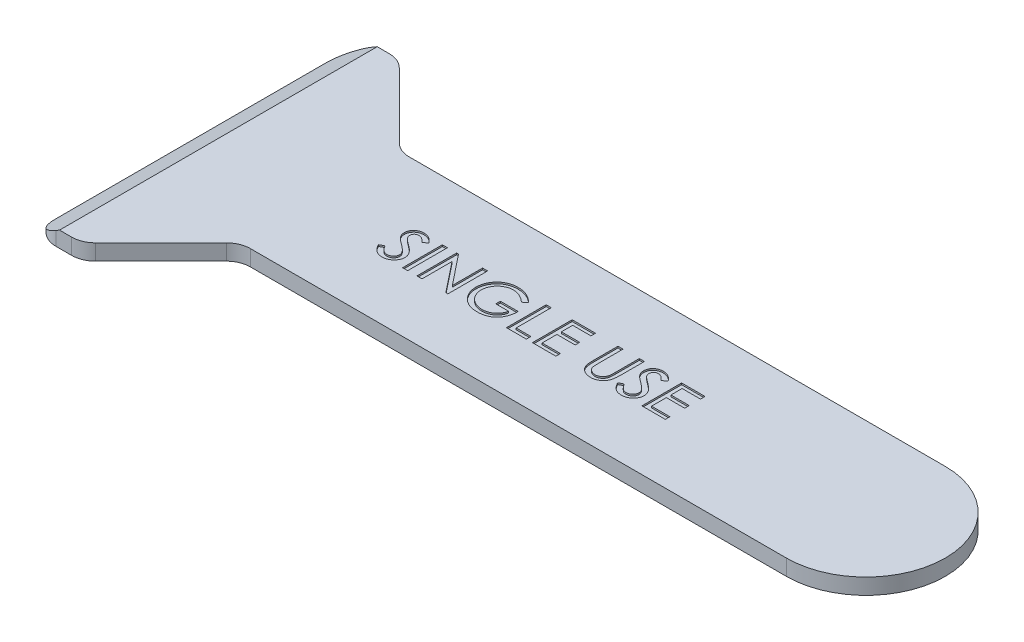
from build123d import *

# Parameters (mm, degrees)
BOSS_EXTRUDE1_DEPTH = 2
SKETCH2_W           = 0.641025641
SKETCH2_H           = 5
CUT_EXTRUDE1_DEPTH  = 0.2
CUT_EXTRUDE2_DEPTH  = 104.097041798


with BuildPart() as part:
    # Sketch1 → Boss-Extrude1 (new body)
    with BuildSketch(Plane(origin=(0, 0, 0), x_dir=(1, 0, 0), z_dir=(0, 1, 0))):
        with BuildLine():
            Line((3, 0), (5, 0))
            ThreePointArc((5, 0), (6.148050297, 0.228361402), (7.121320344, 0.878679656))
            Line((7.121320344, 0.878679656), (15.363961031, 9.121320344))
            ThreePointArc((15.363961031, 9.121320344), (16.337231077, 9.771638598), (17.485281374, 10))
            Line((17.485281374, 10), (85, 10))
            ThreePointArc((85, 10), (95, 20), (85, 30))
            Line((85, 30), (17.485281374, 30))
            ThreePointArc((17.485281374, 30), (16.337231077, 30.228361402), (15.363961031, 30.878679656))
            Line((15.363961031, 30.878679656), (7.121320344, 39.121320344))
            ThreePointArc((7.121320344, 39.121320344), (6.148050297, 39.771638598), (5, 40))
            Line((5, 40), (3, 40))
            ThreePointArc((3, 40), (0.878679656, 39.121320344), (0, 37))
            Line((0, 37), (0, 3))
            ThreePointArc((0, 3), (0.878679656, 0.878679656), (3, 0))
        make_face()
    extrude(amount=BOSS_EXTRUDE1_DEPTH)

    # Sketch2 → Cut-Extrude1 (cut)
    with BuildSketch(Plane(origin=(0, 2, 0), x_dir=(1, 0, 0), z_dir=(0, 1, 0))):
        with BuildLine():
            Line((25.128205128, 18.491586538), (25.673076923, 18.782051282))
            add(Edge.make_bspline(
                [(25.673076923, 18.782051282), (25.712784796, 18.716278253), (25.788677543, 18.590567773), (25.913297284, 18.421220831), (26.03720306, 18.276812397), (26.161617968, 18.157488278), (26.288270225, 18.065165172), (26.415866854, 17.998441335), (26.545206456, 17.956503185), (26.632657136, 17.951285127), (26.67568109, 17.948717949)],
                knots=[0, 0, 0, 0, 1.354943589, 2.589672558, 3.704607527, 4.708856974, 5.624398268, 6.459549776, 7.242129862, 8, 8, 8, 8], degree=3))
            add(Edge.make_bspline(
                [(26.67568109, 17.948717949), (26.715846266, 17.950009025), (26.795401925, 17.952566275), (26.912293458, 17.974743935), (27.025475413, 18.00853487), (27.132986556, 18.056652412), (27.232312083, 18.115602302), (27.31999469, 18.185720667), (27.394390938, 18.26510499), (27.455710693, 18.352678368), (27.503776775, 18.446180069), (27.53916079, 18.542956909), (27.559927676, 18.643287737), (27.562700789, 18.710843417), (27.564102564, 18.744991987)],
                knots=[0, 0, 0, 0, 1.0888553, 2.156709112, 3.216967111, 4.287545289, 5.343926646, 6.34269433, 7.323221176, 8.28571565, 9.233736345, 10.167849744, 11.073870434, 12, 12, 12, 12], degree=3))
            add(Edge.make_bspline(
                [(27.564102564, 18.744991987), (27.562138546, 18.783910579), (27.558169715, 18.862556151), (27.526314915, 18.979385088), (27.474545052, 19.095070908), (27.426656761, 19.167300865), (27.401842949, 19.204727564)],
                knots=[0, 0, 0, 0, 0.941861274, 1.903286225, 2.913566088, 4, 4, 4, 4], degree=3))
            add(Edge.make_bspline(
                [(27.401842949, 19.204727564), (27.38038635, 19.231971484), (27.335218388, 19.289322248), (27.258761839, 19.375664715), (27.169297642, 19.465732718), (27.066970923, 19.559119929), (26.953580275, 19.657918875), (26.827199575, 19.759576046), (26.688722244, 19.865809467), (26.591681174, 19.937079153), (26.541466346, 19.973958333)],
                knots=[0, 0, 0, 0, 0.718593868, 1.512701116, 2.388487339, 3.348232282, 4.383172848, 5.504845107, 6.708858268, 8, 8, 8, 8], degree=3))
            add(Edge.make_bspline(
                [(26.541466346, 19.973958333), (26.490260365, 20.011183426), (26.392010425, 20.082607956), (26.25358484, 20.187316647), (26.12947283, 20.283863863), (26.020626135, 20.372325064), (25.927032384, 20.453469116), (25.848888739, 20.52696305), (25.783842752, 20.590789999), (25.748888893, 20.633735765), (25.733173077, 20.653044872)],
                knots=[0, 0, 0, 0, 1.435833971, 2.754963323, 3.936484598, 5.002077172, 5.935979083, 6.744956812, 7.435712417, 8, 8, 8, 8], degree=3))
            add(Edge.make_bspline(
                [(25.733173077, 20.653044872), (25.710230109, 20.68268942), (25.665156802, 20.740928519), (25.608092435, 20.834347806), (25.558989825, 20.928989733), (25.518546545, 21.025730627), (25.487205438, 21.124261432), (25.465644239, 21.22492769), (25.450435343, 21.327329533), (25.449292476, 21.396511735), (25.448717949, 21.431290064)],
                knots=[0, 0, 0, 0, 1.064105702, 2.090521257, 3.104283852, 4.09061442, 5.065433238, 6.036507983, 7.012940167, 8, 8, 8, 8], degree=3))
            add(Edge.make_bspline(
                [(25.448717949, 21.431290064), (25.450527203, 21.485526289), (25.454109395, 21.592910046), (25.486121216, 21.749674244), (25.537996923, 21.899042527), (25.60880671, 22.040242896), (25.699229518, 22.170647035), (25.806783775, 22.287679611), (25.932051421, 22.388843371), (26.071690104, 22.474084547), (26.222204141, 22.543215707), (26.380730695, 22.592489233), (26.545347984, 22.622360588), (26.657194699, 22.626242512), (26.713741987, 22.628205128)],
                knots=[0, 0, 0, 0, 1.004530234, 1.988896367, 2.951881425, 3.928924249, 4.907494835, 5.884204368, 6.865296418, 7.88218147, 8.909671266, 9.927572845, 10.952225504, 12, 12, 12, 12], degree=3))
            add(Edge.make_bspline(
                [(26.713741987, 22.628205128), (26.777948206, 22.625906957), (26.905108932, 22.621355417), (27.092555797, 22.590510369), (27.271801053, 22.534975978), (27.416163324, 22.473676324), (27.528306402, 22.411002253), (27.613122506, 22.354396838), (27.700054638, 22.290335624), (27.786349399, 22.215625207), (27.875370092, 22.133880358), (27.962558142, 22.040657616), (28.053431219, 21.941299692), (28.111350392, 21.869645277), (28.141025641, 21.832932692)],
                knots=[0, 0, 0, 0, 1.360590218, 2.69465552, 4.010645498, 5.328858611, 6.009843139, 6.729980544, 7.488405022, 8.296451933, 9.147430815, 10.048128915, 10.999946711, 12, 12, 12, 12], degree=3))
            Line((28.141025641, 21.832932692), (27.618189103, 21.474358974))
            add(Edge.make_bspline(
                [(27.618189103, 21.474358974), (27.59090368, 21.503492421), (27.538440659, 21.559508728), (27.461268646, 21.638948411), (27.388253398, 21.710239848), (27.319173327, 21.773056905), (27.255576764, 21.828519844), (27.195676703, 21.874758443), (27.141346295, 21.914498418), (27.073428466, 21.953885119), (26.990166332, 21.99289312), (26.887690183, 22.027991374), (26.780197115, 22.046749233), (26.707462924, 22.049759448), (26.670673077, 22.051282051)],
                knots=[0, 0, 0, 0, 1.253377364, 2.409930098, 3.477532466, 4.457083962, 5.341772995, 6.126101147, 6.832963523, 7.453284126, 8.588253012, 9.715448048, 10.844445545, 12, 12, 12, 12], degree=3))
            add(Edge.make_bspline(
                [(26.670673077, 22.051282051), (26.631403842, 22.049446918), (26.555061244, 22.04587927), (26.445399106, 22.015328361), (26.34459309, 21.967120071), (26.255653921, 21.89889243), (26.181730467, 21.814444878), (26.127516483, 21.715525269), (26.095788966, 21.602793224), (26.091815585, 21.523645097), (26.08974359, 21.482371795)],
                knots=[0, 0, 0, 0, 1.033513523, 2.009234674, 2.977584268, 3.963375862, 4.942860848, 5.915719707, 6.913112236, 8, 8, 8, 8], degree=3))
            add(Edge.make_bspline(
                [(26.08974359, 21.482371795), (26.090550904, 21.455628024), (26.092163579, 21.40220517), (26.104009135, 21.323070732), (26.125905639, 21.246608092), (26.153652935, 21.171205601), (26.192489642, 21.097286928), (26.241950507, 21.02473535), (26.300665118, 20.95146066), (26.345726424, 20.90539666), (26.369190705, 20.881410256)],
                knots=[0, 0, 0, 0, 0.940834015, 1.879392378, 2.805520916, 3.734846727, 4.701501436, 5.734192883, 6.820151034, 8, 8, 8, 8], degree=3))
            add(Edge.make_bspline(
                [(26.369190705, 20.881410256), (26.38107167, 20.87023323), (26.408340975, 20.844579612), (26.45835581, 20.805296313), (26.51929109, 20.756045549), (26.591991595, 20.697631179), (26.678847882, 20.633224609), (26.776648566, 20.558522947), (26.88786997, 20.47688918), (26.966136783, 20.419658369), (27.007211538, 20.389623397)],
                knots=[0, 0, 0, 0, 0.485581606, 1.114511607, 1.892484918, 2.819534315, 3.891398566, 5.11240712, 6.484579029, 8, 8, 8, 8], degree=3))
            add(Edge.make_bspline(
                [(27.007211538, 20.389623397), (27.063171261, 20.348834488), (27.171427292, 20.269926922), (27.325208701, 20.150905244), (27.463897812, 20.034234723), (27.59100102, 19.923985722), (27.702219909, 19.815533513), (27.799638345, 19.711108003), (27.884479721, 19.611728466), (27.975091329, 19.485022335), (28.065684772, 19.328815444), (28.146694034, 19.140010067), (28.195034801, 18.949715237), (28.201792714, 18.822704499), (28.205128205, 18.760016026)],
                knots=[0, 0, 0, 0, 1.186540699, 2.295404303, 3.331123753, 4.291760032, 5.17774712, 5.991329992, 6.738459906, 7.414799035, 8.65800623, 9.82461674, 10.926299804, 12, 12, 12, 12], degree=3))
            add(Edge.make_bspline(
                [(28.205128205, 18.760016026), (28.203708966, 18.715539468), (28.200888119, 18.627138909), (28.1804362, 18.496433023), (28.146406007, 18.369391385), (28.097447409, 18.246550449), (28.036381625, 18.126757322), (27.960664139, 18.01105931), (27.870541748, 17.899902242), (27.769816567, 17.792614438), (27.658439949, 17.694012762), (27.53900117, 17.607230284), (27.411864886, 17.534732684), (27.278010797, 17.475913466), (27.138224295, 17.427983109), (26.991123967, 17.395154823), (26.837437354, 17.376205852), (26.73282488, 17.373280692), (26.6796875, 17.371794872)],
                knots=[0, 0, 0, 0, 0.932646097, 1.853705421, 2.767602683, 3.685675702, 4.622099834, 5.5835355, 6.579838097, 7.620108014, 8.666886363, 9.695041649, 10.711275682, 11.730160242, 12.757671447, 13.80585424, 14.885494678, 16, 16, 16, 16], degree=3))
            add(Edge.make_bspline(
                [(26.6796875, 17.371794872), (26.640939118, 17.372655523), (26.564620829, 17.374350649), (26.451320406, 17.38510314), (26.34106498, 17.405769319), (26.23325006, 17.432488607), (26.127808355, 17.466512013), (26.026098718, 17.510034186), (25.926427446, 17.560025417), (25.829366304, 17.61855997), (25.734791518, 17.687099323), (25.642165633, 17.76666003), (25.55202669, 17.858640672), (25.462829516, 17.961846225), (25.375752524, 18.077437539), (25.290999004, 18.204806797), (25.207486806, 18.343543269), (25.155153241, 18.441266126), (25.128205128, 18.491586538)],
                knots=[0, 0, 0, 0, 0.916943493, 1.805999526, 2.689245248, 3.568702553, 4.433092864, 5.307568578, 6.183755457, 7.069823058, 7.986358083, 8.944343836, 9.955449961, 11.030835633, 12.170024038, 13.377301724, 14.649494474, 16, 16, 16, 16], degree=3))
        make_face()
        with Locations((29.487179488, 20)):
            Rectangle(SKETCH2_W, SKETCH2_H)
        Polygon((30.961538462, 17.5), (30.961538462, 22.5), (31.198918269, 22.5), (34.230769231, 18.700921474), (34.230769231, 22.5), (34.871794872, 22.5), (34.871794872, 17.5), (34.609375, 17.5), (31.602564103, 21.2890625), (31.602564103, 17.5), align=None)
        with BuildLine():
            Line((40.897435897, 21.640625), (40.411658654, 21.217948718))
            add(Edge.make_bspline(
                [(40.411658654, 21.217948718), (40.335446854, 21.284496998), (40.187082405, 21.4140491), (39.954775024, 21.585180935), (39.72116776, 21.729525953), (39.486198759, 21.845360964), (39.253834217, 21.93813722), (39.023015299, 22.001920573), (38.795577311, 22.043591203), (38.644336243, 22.048741041), (38.569711538, 22.051282051)],
                knots=[0, 0, 0, 0, 1.174203348, 2.285866929, 3.345479548, 4.357773815, 5.323690501, 6.245291137, 7.134199255, 8, 8, 8, 8], degree=3))
            add(Edge.make_bspline(
                [(38.569711538, 22.051282051), (38.52660663, 22.050606825), (38.44053159, 22.049258483), (38.312110068, 22.035393584), (38.184940676, 22.014711513), (38.058945995, 21.985111948), (37.933859478, 21.94861599), (37.810638609, 21.902075364), (37.688525183, 21.847635147), (37.568508907, 21.784984706), (37.451857943, 21.715484898), (37.340989509, 21.63899676), (37.236594809, 21.555644489), (37.138478211, 21.465663916), (37.04721594, 21.368917699), (36.961455539, 21.266797645), (36.883418182, 21.156909857), (36.811584795, 21.041620762), (36.748237731, 20.921749146), (36.691220842, 20.800179573), (36.64428275, 20.675881055), (36.606295977, 20.549267417), (36.576040526, 20.420504254), (36.554077387, 20.289733412), (36.540486097, 20.156539844), (36.539140447, 20.067139584), (36.538461538, 20.022035256)],
                knots=[0, 0, 0, 0, 0.9732313, 1.943419598, 2.914105962, 3.881741322, 4.864768402, 5.855028487, 6.854206409, 7.882911434, 8.911035887, 9.919250175, 10.922630637, 11.925982763, 12.923451909, 13.924676513, 14.935397504, 15.964931351, 16.990480746, 17.995899336, 18.995873688, 19.988284801, 20.979664002, 21.981342857, 22.981544644, 24, 24, 24, 24], degree=3))
            add(Edge.make_bspline(
                [(36.538461538, 20.022035256), (36.539609779, 19.975937934), (36.541902309, 19.883901902), (36.554630067, 19.746901395), (36.577931618, 19.612419635), (36.610298948, 19.480305039), (36.651192172, 19.350395268), (36.701345118, 19.222355756), (36.762103007, 19.097469583), (36.829482376, 18.9745893), (36.905305216, 18.856655675), (36.989031178, 18.745493452), (37.077833591, 18.639666759), (37.17437806, 18.542121677), (37.275754506, 18.449594415), (37.385497251, 18.366152746), (37.500522689, 18.287695277), (37.62159699, 18.216620868), (37.747648572, 18.153939106), (37.876587825, 18.098633484), (38.00883599, 18.052395768), (38.143576326, 18.01428429), (38.281515641, 17.985303732), (38.421653027, 17.964507058), (38.564759795, 17.950660587), (38.661158583, 17.94937065), (38.709935897, 17.948717949)],
                knots=[0, 0, 0, 0, 0.993588149, 1.983757546, 2.962012758, 3.932297264, 4.913089422, 5.895147596, 6.892791648, 7.904042674, 8.913936126, 9.911190904, 10.901569418, 11.888649192, 12.866825019, 13.856968273, 14.856789458, 15.866221433, 16.879824684, 17.888846278, 18.887838639, 19.896937192, 20.90452114, 21.923117541, 22.949107649, 24, 24, 24, 24], degree=3))
            add(Edge.make_bspline(
                [(38.709935897, 17.948717949), (38.77076039, 17.950086761), (38.89073899, 17.952786793), (39.066849392, 17.973461899), (39.23619994, 18.005384742), (39.397065099, 18.055000169), (39.55200993, 18.114013463), (39.698723, 18.189190191), (39.838961024, 18.276354719), (39.969710536, 18.377486067), (40.091561579, 18.486411015), (40.200074431, 18.603675251), (40.297117238, 18.725474173), (40.378935147, 18.854732851), (40.449954864, 18.987828441), (40.506211913, 19.12756704), (40.549819799, 19.272761185), (40.567854483, 19.37278218), (40.576923077, 19.423076923)],
                knots=[0, 0, 0, 0, 1.125101743, 2.219305524, 3.276925285, 4.308813505, 5.329771737, 6.340890082, 7.353855978, 8.380572537, 9.395307413, 10.374367262, 11.333343716, 12.272376171, 13.200803521, 14.12078735, 15.055053215, 16, 16, 16, 16], degree=3))
            Line((40.576923077, 19.423076923), (38.974358974, 19.423076923))
            Line((38.974358974, 19.423076923), (38.974358974, 20))
            Line((38.974358974, 20), (41.217948718, 20))
            add(Edge.make_bspline(
                [(41.217948718, 20), (41.215676583, 19.901060213), (41.211241119, 19.70791864), (41.175632699, 19.42638263), (41.123129815, 19.16014998), (41.04642398, 18.910343761), (40.949232739, 18.676611911), (40.830528737, 18.458948878), (40.690545182, 18.257418084), (40.53022633, 18.073155949), (40.351990533, 17.907875224), (40.157728086, 17.763132432), (39.94656807, 17.643000227), (39.721207447, 17.543199148), (39.480398508, 17.466087284), (39.224761284, 17.411469581), (38.953896438, 17.377681617), (38.768130203, 17.373790225), (38.672876603, 17.371794872)],
                knots=[0, 0, 0, 0, 1.147910205, 2.240849596, 3.288798376, 4.293882934, 5.268269983, 6.221997348, 7.165762291, 8.110600512, 9.051082397, 9.981847279, 10.915696266, 11.864665164, 12.837641225, 13.844673414, 14.894833504, 16, 16, 16, 16], degree=3))
            add(Edge.make_bspline(
                [(38.672876603, 17.371794872), (38.616767693, 17.372614911), (38.505778284, 17.374237037), (38.341695034, 17.385603036), (38.181815618, 17.403166911), (38.026800965, 17.429533392), (37.875813851, 17.462153705), (37.7300838, 17.503872302), (37.587627833, 17.550100079), (37.450966418, 17.607246714), (37.317188581, 17.668568525), (37.188512862, 17.739141731), (37.064821203, 17.817748976), (36.943495447, 17.901279296), (36.829198337, 17.995010387), (36.718096338, 18.09446325), (36.611901301, 18.201655155), (36.545085396, 18.277891967), (36.511418269, 18.31630609)],
                knots=[0, 0, 0, 0, 1.103516608, 2.18287355, 3.233646581, 4.265703846, 5.274262808, 6.270085734, 7.246073526, 8.217965859, 9.181570311, 10.139587173, 11.101556858, 12.063436887, 13.034641265, 14.006444858, 14.995489556, 16, 16, 16, 16], degree=3))
            add(Edge.make_bspline(
                [(36.511418269, 18.31630609), (36.462076906, 18.377149267), (36.364454138, 18.497528577), (36.241444436, 18.692520218), (36.133451117, 18.892113742), (36.047598185, 19.10050187), (35.980148501, 19.315651768), (35.931774594, 19.538154208), (35.903633233, 19.767904422), (35.899514956, 19.923468642), (35.897435897, 20.002003205)],
                knots=[0, 0, 0, 0, 1.024988564, 2.027958144, 3.013741914, 3.99376912, 4.974186348, 5.962951834, 6.97162285, 8, 8, 8, 8], degree=3))
            add(Edge.make_bspline(
                [(35.897435897, 20.002003205), (35.89818482, 20.060812784), (35.899668915, 20.177352106), (35.918077613, 20.350524742), (35.944475171, 20.52091543), (35.98261476, 20.688255035), (36.031884365, 20.852202372), (36.092448965, 21.012992867), (36.16314988, 21.171188083), (36.245761689, 21.324858947), (36.335672671, 21.473972113), (36.436719418, 21.613895231), (36.543722823, 21.747262269), (36.66042892, 21.870871506), (36.783488985, 21.9881623), (36.916470159, 22.095010268), (37.056616292, 22.194589876), (37.205131329, 22.284511762), (37.359592265, 22.365318519), (37.519671558, 22.436189281), (37.68505653, 22.494511239), (37.854595056, 22.544573161), (38.029601306, 22.580981794), (38.209162001, 22.607866521), (38.393729062, 22.625946037), (38.518586783, 22.627446369), (38.581730769, 22.628205128)],
                knots=[0, 0, 0, 0, 1.010042427, 2.001538926, 2.988977894, 3.97147212, 4.947868168, 5.928132478, 6.921817128, 7.922678872, 8.924230854, 9.911186466, 10.885946514, 11.860014231, 12.829900618, 13.804660667, 14.788293046, 15.781961137, 16.785220236, 17.781814947, 18.787040195, 19.796447094, 20.816926666, 21.855387176, 22.915410262, 24, 24, 24, 24], degree=3))
            add(Edge.make_bspline(
                [(38.581730769, 22.628205128), (38.634828269, 22.627263116), (38.740445004, 22.62538935), (38.897601015, 22.615638249), (39.052432987, 22.597692298), (39.204599589, 22.570934516), (39.355009774, 22.539727427), (39.502276019, 22.499218941), (39.646971515, 22.452007344), (39.789806869, 22.397774637), (39.931372431, 22.335589673), (40.072065379, 22.264470802), (40.211285001, 22.182645051), (40.350499435, 22.092688825), (40.488836939, 21.993346148), (40.626077329, 21.884556662), (40.763884377, 21.7678296), (40.852441817, 21.683480776), (40.897435897, 21.640625)],
                knots=[0, 0, 0, 0, 0.985310127, 1.959889608, 2.920407961, 3.875718043, 4.825872088, 5.769643135, 6.708031182, 7.649175746, 8.603380435, 9.575831151, 10.572468945, 11.59831001, 12.650450436, 13.731164539, 14.847254788, 16, 16, 16, 16], degree=3))
        make_face()
        Polygon((42.243589744, 22.5), (42.884615385, 22.5), (42.884615385, 18.076923077), (44.743589744, 18.076923077), (44.743589744, 17.5), (42.243589744, 17.5), align=None)
        Polygon((45.512820513, 22.5), (48.461538462, 22.5), (48.461538462, 21.923076923), (46.153846154, 21.923076923), (46.153846154, 20.512820513), (48.461538462, 20.512820513), (48.461538462, 19.935897436), (46.153846154, 19.935897436), (46.153846154, 18.076923077), (48.461538462, 18.076923077), (48.461538462, 17.5), (45.512820513, 17.5), align=None)
        with BuildLine():
            Line((51.282051282, 22.5), (51.923076923, 22.5))
            Line((51.923076923, 22.5), (51.923076923, 19.481169872))
            add(Edge.make_bspline(
                [(51.923076923, 19.481169872), (51.923004675, 19.439102554), (51.922868203, 19.359640576), (51.923772731, 19.246785307), (51.925956432, 19.146965292), (51.928019033, 19.059494234), (51.929638974, 18.98501543), (51.932542258, 18.923222094), (51.936413131, 18.874464926), (51.939708022, 18.846147387), (51.941105769, 18.834134615)],
                knots=[0, 0, 0, 0, 1.55908667, 2.944996726, 4.182614548, 5.259411187, 6.187768874, 6.943477064, 7.551805389, 8, 8, 8, 8], degree=3))
            add(Edge.make_bspline(
                [(51.941105769, 18.834134615), (51.948217155, 18.786892009), (51.961817366, 18.69654261), (51.995594801, 18.569270489), (52.040925291, 18.457030741), (52.096208309, 18.357336652), (52.166798526, 18.269925065), (52.251164111, 18.192207782), (52.350292176, 18.122221154), (52.461292755, 18.061688242), (52.579650953, 18.012469788), (52.699689498, 17.976017492), (52.81959816, 17.952581702), (52.899870103, 17.949999378), (52.939703526, 17.948717949)],
                knots=[0, 0, 0, 0, 1.166957714, 2.231755086, 3.208991316, 4.118778005, 5.006904847, 5.942163703, 6.913386956, 7.965005362, 9.025668557, 10.040039382, 11.027406897, 12, 12, 12, 12], degree=3))
            add(Edge.make_bspline(
                [(52.939703526, 17.948717949), (52.977503881, 17.949850657), (53.052537989, 17.952099095), (53.163397722, 17.97084056), (53.271240431, 18.000903589), (53.375256589, 18.043139214), (53.474254366, 18.095779285), (53.565282877, 18.159114106), (53.648618208, 18.230902084), (53.723264905, 18.312375354), (53.788058521, 18.404462777), (53.84591949, 18.504414103), (53.89175302, 18.61493755), (53.915257115, 18.692357193), (53.927283654, 18.731971154)],
                knots=[0, 0, 0, 0, 0.999732249, 1.98447917, 2.96624928, 3.957159324, 4.949250196, 5.927077037, 6.885351415, 7.854639871, 8.842631176, 9.859548065, 10.904776923, 12, 12, 12, 12], degree=3))
            add(Edge.make_bspline(
                [(53.927283654, 18.731971154), (53.931139593, 18.748962058), (53.939709972, 18.786726777), (53.94936891, 18.84994388), (53.957199049, 18.92514906), (53.962819229, 19.012709231), (53.967724818, 19.112548028), (53.971943124, 19.224727908), (53.973540522, 19.348954169), (53.974077899, 19.435763924), (53.974358974, 19.481169872)],
                knots=[0, 0, 0, 0, 0.555909564, 1.235588686, 2.039259232, 2.968460287, 4.03530762, 5.229446682, 6.550858702, 8, 8, 8, 8], degree=3))
            Line((53.974358974, 19.481169872), (53.974358974, 22.5))
            Line((53.974358974, 22.5), (54.615384615, 22.5))
            Line((54.615384615, 22.5), (54.615384615, 19.491185897))
            add(Edge.make_bspline(
                [(54.615384615, 19.491185897), (54.615015569, 19.438095239), (54.614293478, 19.334215738), (54.608214249, 19.182238367), (54.598332737, 19.037934134), (54.584494932, 18.901268366), (54.566080241, 18.772100223), (54.545978776, 18.649839413), (54.519602981, 18.535632715), (54.489667328, 18.428055539), (54.453466723, 18.325714039), (54.40905365, 18.226831245), (54.355934039, 18.130598916), (54.293558634, 18.037169258), (54.222112959, 17.947147358), (54.142478235, 17.859469328), (54.054284579, 17.774730376), (53.959096555, 17.692746002), (53.855984159, 17.617443834), (53.746203371, 17.551410293), (53.630074682, 17.495933355), (53.508182928, 17.451145548), (53.380840097, 17.414421278), (53.247272874, 17.390116762), (53.108013979, 17.374453152), (53.013198768, 17.372693923), (52.96474359, 17.371794872)],
                knots=[0, 0, 0, 0, 1.249746778, 2.445309111, 3.579791402, 4.654321124, 5.678008809, 6.650959404, 7.569940487, 8.435761916, 9.278480968, 10.122774478, 10.984627263, 11.863091158, 12.76404959, 13.687656952, 14.649240315, 15.641521383, 16.642911538, 17.65112545, 18.653008962, 19.667635542, 20.705108869, 21.768718231, 22.859706637, 24, 24, 24, 24], degree=3))
            add(Edge.make_bspline(
                [(52.96474359, 17.371794872), (52.915976035, 17.372920001), (52.819939004, 17.375135698), (52.678578921, 17.387751487), (52.542735265, 17.41108563), (52.412184773, 17.443157584), (52.286279975, 17.483901997), (52.166282695, 17.53574969), (52.050225785, 17.594138819), (51.9418556, 17.66383421), (51.839227528, 17.739171867), (51.746566691, 17.82315369), (51.660104379, 17.910716571), (51.585661591, 18.006912267), (51.517578139, 18.107027482), (51.459890486, 18.21408562), (51.408644645, 18.326030408), (51.383742664, 18.404811423), (51.37119391, 18.444511218)],
                knots=[0, 0, 0, 0, 1.133329185, 2.231843898, 3.29426245, 4.332905112, 5.353485079, 6.365031746, 7.367763869, 8.368573437, 9.35539345, 10.32243748, 11.271609842, 12.210613971, 13.14444413, 14.081844494, 15.03339173, 16, 16, 16, 16], degree=3))
            add(Edge.make_bspline(
                [(51.37119391, 18.444511218), (51.363809706, 18.471131468), (51.347880902, 18.52855522), (51.330546884, 18.62340317), (51.316063732, 18.732760042), (51.302616552, 18.856602944), (51.294527061, 18.995000223), (51.28752102, 19.1475846), (51.282009543, 19.314531694), (51.282037003, 19.430751035), (51.282051282, 19.491185897)],
                knots=[0, 0, 0, 0, 0.629181127, 1.357235188, 2.194217397, 3.14266044, 4.194662557, 5.352158634, 6.623104138, 8, 8, 8, 8], degree=3))
            Line((51.282051282, 19.491185897), (51.282051282, 22.5))
        make_face()
        with BuildLine():
            Line((55.256410256, 18.491586538), (55.801282051, 18.782051282))
            add(Edge.make_bspline(
                [(55.801282051, 18.782051282), (55.840989925, 18.716278253), (55.916882671, 18.590567773), (56.041502412, 18.421220831), (56.165408188, 18.276812397), (56.289823096, 18.157488278), (56.416475354, 18.065165172), (56.544071983, 17.998441335), (56.673411584, 17.956503185), (56.760862264, 17.951285127), (56.803886218, 17.948717949)],
                knots=[0, 0, 0, 0, 1.354943589, 2.589672558, 3.704607527, 4.708856974, 5.624398268, 6.459549776, 7.242129862, 8, 8, 8, 8], degree=3))
            add(Edge.make_bspline(
                [(56.803886218, 17.948717949), (56.844051394, 17.950009025), (56.923607053, 17.952566275), (57.040498586, 17.974743935), (57.153680542, 18.00853487), (57.261191684, 18.056652412), (57.360517211, 18.115602302), (57.448199818, 18.185720667), (57.522596066, 18.26510499), (57.583915821, 18.352678368), (57.631981903, 18.446180069), (57.667365918, 18.542956909), (57.688132804, 18.643287737), (57.690905917, 18.710843417), (57.692307692, 18.744991987)],
                knots=[0, 0, 0, 0, 1.0888553, 2.156709112, 3.216967111, 4.287545289, 5.343926646, 6.34269433, 7.323221176, 8.28571565, 9.233736345, 10.167849744, 11.073870434, 12, 12, 12, 12], degree=3))
            add(Edge.make_bspline(
                [(57.692307692, 18.744991987), (57.690343674, 18.783910579), (57.686374843, 18.862556151), (57.654520044, 18.979385088), (57.60275018, 19.095070908), (57.55486189, 19.167300865), (57.530048077, 19.204727564)],
                knots=[0, 0, 0, 0, 0.941861274, 1.903286225, 2.913566088, 4, 4, 4, 4], degree=3))
            add(Edge.make_bspline(
                [(57.530048077, 19.204727564), (57.508591478, 19.231971484), (57.463423516, 19.289322248), (57.386966967, 19.375664715), (57.29750277, 19.465732718), (57.195176051, 19.559119929), (57.081785403, 19.657918875), (56.955404703, 19.759576046), (56.816927372, 19.865809467), (56.719886303, 19.937079153), (56.669671474, 19.973958333)],
                knots=[0, 0, 0, 0, 0.718593868, 1.512701116, 2.388487339, 3.348232282, 4.383172848, 5.504845107, 6.708858268, 8, 8, 8, 8], degree=3))
            add(Edge.make_bspline(
                [(56.669671474, 19.973958333), (56.618465493, 20.011183426), (56.520215554, 20.082607956), (56.381789968, 20.187316647), (56.257677958, 20.283863863), (56.148831263, 20.372325064), (56.055237512, 20.453469116), (55.977093867, 20.52696305), (55.912047881, 20.590789999), (55.877094022, 20.633735765), (55.861378205, 20.653044872)],
                knots=[0, 0, 0, 0, 1.435833971, 2.754963323, 3.936484598, 5.002077172, 5.935979083, 6.744956812, 7.435712417, 8, 8, 8, 8], degree=3))
            add(Edge.make_bspline(
                [(55.861378205, 20.653044872), (55.838435237, 20.68268942), (55.79336193, 20.740928519), (55.736297563, 20.834347806), (55.687194953, 20.928989733), (55.646751673, 21.025730627), (55.615410567, 21.124261432), (55.593849367, 21.22492769), (55.578640472, 21.327329533), (55.577497604, 21.396511735), (55.576923077, 21.431290064)],
                knots=[0, 0, 0, 0, 1.064105702, 2.090521257, 3.104283852, 4.09061442, 5.065433238, 6.036507983, 7.012940167, 8, 8, 8, 8], degree=3))
            add(Edge.make_bspline(
                [(55.576923077, 21.431290064), (55.578732332, 21.485526289), (55.582314524, 21.592910046), (55.614326345, 21.749674244), (55.666202051, 21.899042527), (55.737011839, 22.040242896), (55.827434647, 22.170647035), (55.934988903, 22.287679611), (56.06025655, 22.388843371), (56.199895232, 22.474084547), (56.350409269, 22.543215707), (56.508935823, 22.592489233), (56.673553113, 22.622360588), (56.785399827, 22.626242512), (56.841947115, 22.628205128)],
                knots=[0, 0, 0, 0, 1.004530234, 1.988896367, 2.951881425, 3.928924249, 4.907494835, 5.884204368, 6.865296418, 7.88218147, 8.909671266, 9.927572845, 10.952225504, 12, 12, 12, 12], degree=3))
            add(Edge.make_bspline(
                [(56.841947115, 22.628205128), (56.906153334, 22.625906957), (57.03331406, 22.621355417), (57.220760926, 22.590510369), (57.400006181, 22.534975978), (57.544368452, 22.473676324), (57.65651153, 22.411002253), (57.741327634, 22.354396838), (57.828259766, 22.290335624), (57.914554528, 22.215625207), (58.003575221, 22.133880358), (58.090763271, 22.040657616), (58.181636347, 21.941299692), (58.23955552, 21.869645277), (58.269230769, 21.832932692)],
                knots=[0, 0, 0, 0, 1.360590218, 2.69465552, 4.010645498, 5.328858611, 6.009843139, 6.729980544, 7.488405022, 8.296451933, 9.147430815, 10.048128915, 10.999946711, 12, 12, 12, 12], degree=3))
            Line((58.269230769, 21.832932692), (57.746394231, 21.474358974))
            add(Edge.make_bspline(
                [(57.746394231, 21.474358974), (57.719108808, 21.503492421), (57.666645787, 21.559508728), (57.589473774, 21.638948411), (57.516458527, 21.710239848), (57.447378456, 21.773056905), (57.383781892, 21.828519844), (57.323881831, 21.874758443), (57.269551423, 21.914498418), (57.201633594, 21.953885119), (57.11837146, 21.99289312), (57.015895311, 22.027991374), (56.908402243, 22.046749233), (56.835668053, 22.049759448), (56.798878205, 22.051282051)],
                knots=[0, 0, 0, 0, 1.253377364, 2.409930098, 3.477532466, 4.457083962, 5.341772995, 6.126101147, 6.832963523, 7.453284126, 8.588253012, 9.715448048, 10.844445545, 12, 12, 12, 12], degree=3))
            add(Edge.make_bspline(
                [(56.798878205, 22.051282051), (56.759608971, 22.049446918), (56.683266372, 22.04587927), (56.573604234, 22.015328361), (56.472798218, 21.967120071), (56.38385905, 21.89889243), (56.309935595, 21.814444878), (56.255721611, 21.715525269), (56.223994094, 21.602793224), (56.220020713, 21.523645097), (56.217948718, 21.482371795)],
                knots=[0, 0, 0, 0, 1.033513523, 2.009234674, 2.977584268, 3.963375862, 4.942860848, 5.915719707, 6.913112236, 8, 8, 8, 8], degree=3))
            add(Edge.make_bspline(
                [(56.217948718, 21.482371795), (56.218756032, 21.455628024), (56.220368707, 21.40220517), (56.232214263, 21.323070732), (56.254110767, 21.246608092), (56.281858063, 21.171205601), (56.32069477, 21.097286928), (56.370155635, 21.02473535), (56.428870247, 20.95146066), (56.473931552, 20.90539666), (56.497395833, 20.881410256)],
                knots=[0, 0, 0, 0, 0.940834015, 1.879392378, 2.805520916, 3.734846727, 4.701501436, 5.734192883, 6.820151034, 8, 8, 8, 8], degree=3))
            add(Edge.make_bspline(
                [(56.497395833, 20.881410256), (56.509276798, 20.87023323), (56.536546104, 20.844579612), (56.586560938, 20.805296313), (56.647496218, 20.756045549), (56.720196723, 20.697631179), (56.80705301, 20.633224609), (56.904853695, 20.558522947), (57.016075098, 20.47688918), (57.094341912, 20.419658369), (57.135416667, 20.389623397)],
                knots=[0, 0, 0, 0, 0.485581606, 1.114511607, 1.892484918, 2.819534315, 3.891398566, 5.11240712, 6.484579029, 8, 8, 8, 8], degree=3))
            add(Edge.make_bspline(
                [(57.135416667, 20.389623397), (57.191376389, 20.348834488), (57.29963242, 20.269926922), (57.453413829, 20.150905244), (57.592102941, 20.034234723), (57.719206148, 19.923985722), (57.830425037, 19.815533513), (57.927843474, 19.711108003), (58.01268485, 19.611728466), (58.103296457, 19.485022335), (58.1938899, 19.328815444), (58.274899162, 19.140010067), (58.323239929, 18.949715237), (58.329997842, 18.822704499), (58.333333333, 18.760016026)],
                knots=[0, 0, 0, 0, 1.186540699, 2.295404303, 3.331123753, 4.291760032, 5.17774712, 5.991329992, 6.738459906, 7.414799035, 8.65800623, 9.82461674, 10.926299804, 12, 12, 12, 12], degree=3))
            add(Edge.make_bspline(
                [(58.333333333, 18.760016026), (58.331914094, 18.715539468), (58.329093247, 18.627138909), (58.308641329, 18.496433023), (58.274611135, 18.369391385), (58.225652537, 18.246550449), (58.164586754, 18.126757322), (58.088869267, 18.01105931), (57.998746876, 17.899902242), (57.898021695, 17.792614438), (57.786645077, 17.694012762), (57.667206298, 17.607230284), (57.540070014, 17.534732684), (57.406215925, 17.475913466), (57.266429423, 17.427983109), (57.119329096, 17.395154823), (56.965642482, 17.376205852), (56.861030009, 17.373280692), (56.807892628, 17.371794872)],
                knots=[0, 0, 0, 0, 0.932646097, 1.853705421, 2.767602683, 3.685675702, 4.622099834, 5.5835355, 6.579838097, 7.620108014, 8.666886363, 9.695041649, 10.711275682, 11.730160242, 12.757671447, 13.80585424, 14.885494678, 16, 16, 16, 16], degree=3))
            add(Edge.make_bspline(
                [(56.807892628, 17.371794872), (56.769144247, 17.372655523), (56.692825957, 17.374350649), (56.579525534, 17.38510314), (56.469270109, 17.405769319), (56.361455188, 17.432488607), (56.256013483, 17.466512013), (56.154303846, 17.510034186), (56.054632575, 17.560025417), (55.957571432, 17.61855997), (55.862996646, 17.687099323), (55.770370761, 17.76666003), (55.680231818, 17.858640672), (55.591034644, 17.961846225), (55.503957652, 18.077437539), (55.419204133, 18.204806797), (55.335691934, 18.343543269), (55.283358369, 18.441266126), (55.256410256, 18.491586538)],
                knots=[0, 0, 0, 0, 0.916943493, 1.805999526, 2.689245248, 3.568702553, 4.433092864, 5.307568578, 6.183755457, 7.069823058, 7.986358083, 8.944343836, 9.955449961, 11.030835633, 12.170024038, 13.377301724, 14.649494474, 16, 16, 16, 16], degree=3))
        make_face()
        Polygon((59.294871795, 22.5), (62.243589744, 22.5), (62.243589744, 21.923076923), (59.935897436, 21.923076923), (59.935897436, 20.512820513), (62.243589744, 20.512820513), (62.243589744, 19.935897436), (59.935897436, 19.935897436), (59.935897436, 18.076923077), (62.243589744, 18.076923077), (62.243589744, 17.5), (59.294871795, 17.5), align=None)
    extrude(amount=-CUT_EXTRUDE1_DEPTH, mode=Mode.SUBTRACT)

    # Sketch3 → Cut-Extrude2 (cut, through all)
    with BuildSketch(Plane.XY):
        Polygon((0, 0), (8.660254038, 5), (0, 5), align=None)
    extrude(amount=-CUT_EXTRUDE2_DEPTH, mode=Mode.SUBTRACT)


solid = part.part
